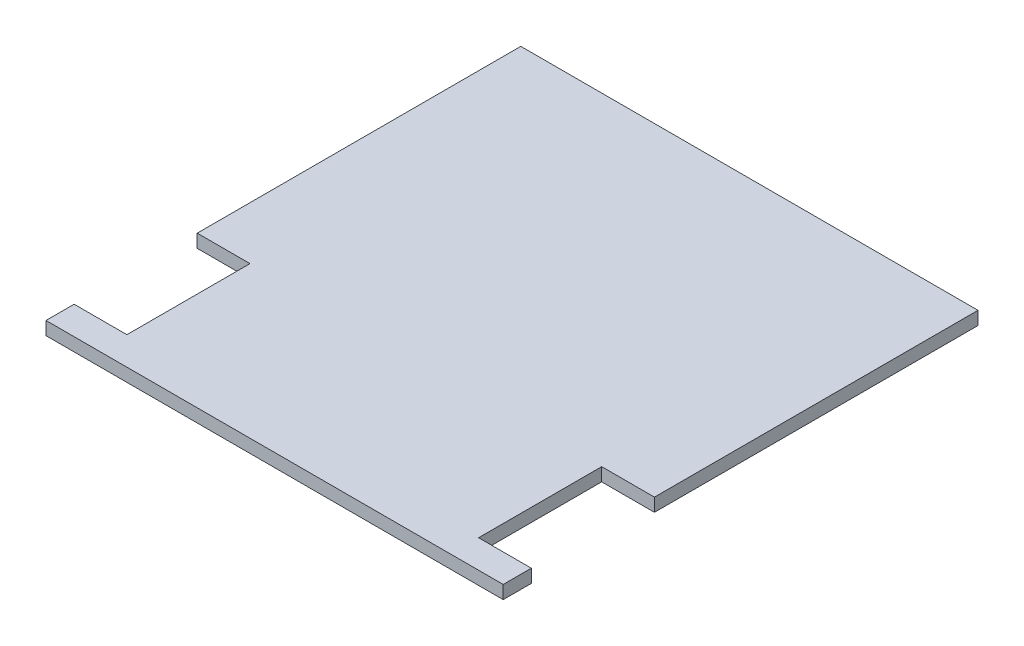
from build123d import *

# Parameters (mm, degrees)
BOSS_EXTRUDE1_DEPTH = 0.75


with BuildPart() as part:
    # Sketch1 → Boss-Extrude1 (new body)
    with BuildSketch(Plane(origin=(0, 0, 0), x_dir=(1, 0, 0), z_dir=(0, 1, 0))):
        Polygon((-19.385235072, 35), (6.614764928, 35), (6.614764928, 16.6), (3.614764928, 16.6), (3.614764928, 9.6), (6.614764928, 9.6), (6.614764928, 8), (-19.385235072, 8), (-19.385235072, 9.6), (-16.385235072, 9.6), (-16.385235072, 16.6), (-19.385235072, 16.6), align=None)
    extrude(amount=BOSS_EXTRUDE1_DEPTH)


solid = part.part
